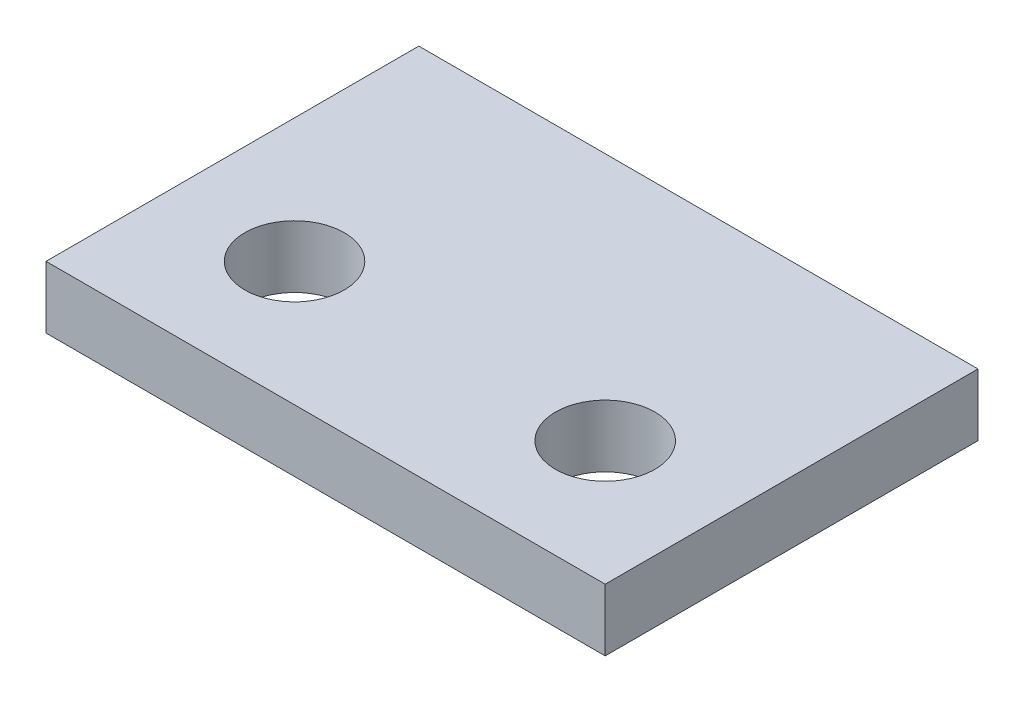
from build123d import *

# Parameters (mm, degrees)
SKETCH_1_W      = 18
SKETCH_1_H      = 12
SKETCH_1_R      = 1.6
EXTRUDE_1_DEPTH = 2


with BuildPart() as part:
    # 草图1 → 凸台-拉伸1 (new body)
    with BuildSketch(Plane(origin=(0, 0, 0), x_dir=(1, 0, 0), z_dir=(0, 1, 0))):
        with Locations((0, 2)):
            Rectangle(SKETCH_1_W, SKETCH_1_H)
        with Locations(Location((-5, 0, 0), (0, 0, 270))):
            Circle(SKETCH_1_R, mode=Mode.SUBTRACT)
        with Locations(Location((5, 0, 0), (0, 0, 90))):
            Circle(SKETCH_1_R, mode=Mode.SUBTRACT)
    extrude(amount=EXTRUDE_1_DEPTH)


solid = part.part
